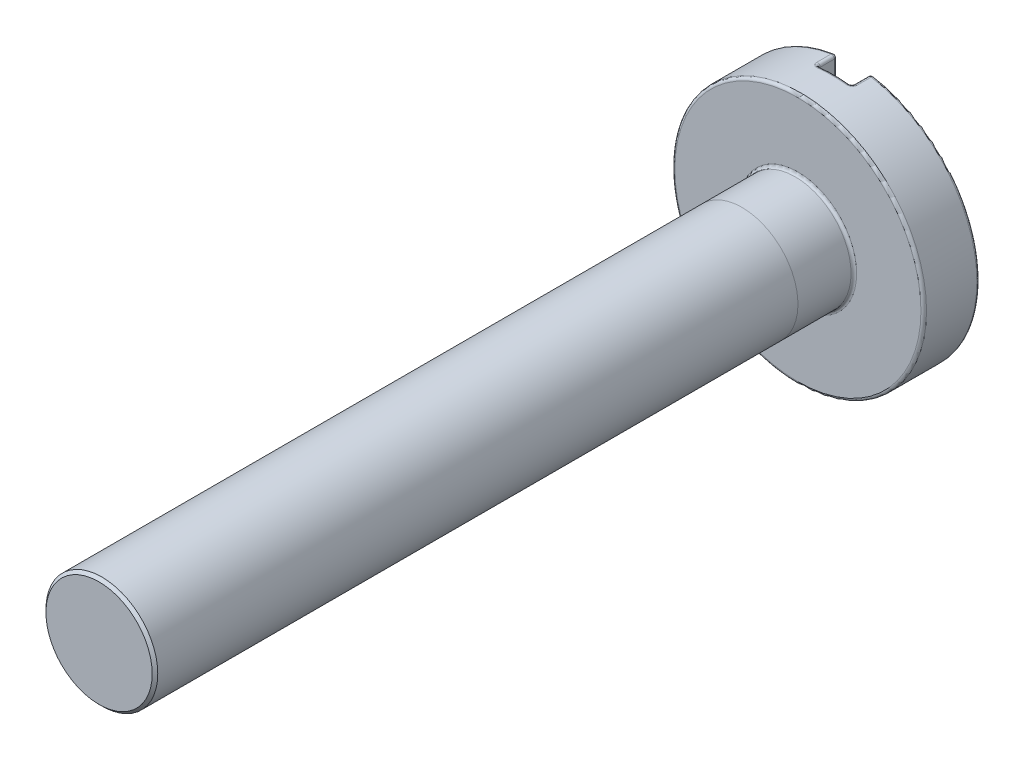
from build123d import *

# Parameters (mm, degrees)
SKETCH1_R           = 1
BOSS_EXTRUDE1_DEPTH = 12.5
SKETCH2_R           = 2.25
BOSS_EXTRUDE2_DEPTH = 1
SKETCH3_W           = 0.6
SKETCH3_H           = 8.393754192
CUT_EXTRUDE1_DEPTH  = 0.35
FILLET1_R           = 0.05
FILLET2_R           = 0.05
CHAMFER1_SIZE       = 0.05


with BuildPart() as part:
    # Sketch1 → Boss-Extrude1 (new body)
    with BuildSketch(Plane.XY):
        Circle(SKETCH1_R)
    extrude(amount=BOSS_EXTRUDE1_DEPTH)

    # Sketch2 → Boss-Extrude2 (add)
    with BuildSketch(Plane.XY):
        Circle(SKETCH2_R)
    extrude(amount=-BOSS_EXTRUDE2_DEPTH)

    # Sketch3 → Cut-Extrude1 (cut)
    with BuildSketch(Plane(origin=(0, 0, -1), x_dir=(-1, 0, 0), z_dir=(0, 0, -1))):
        Rectangle(SKETCH3_W, SKETCH3_H)
    extrude(amount=-CUT_EXTRUDE1_DEPTH, mode=Mode.SUBTRACT)

    # Fillet1
    fillet1_edges = [part.edges().sort_by_distance(p)[0] for p in [
        (-2.25, 0, -1),
        (1.693738469, -1.481131324, -1),
        (0.3, 0, -1),
        (-0.3, 0, -1),
        (0, 2.25, -0.65),
        (0, -2.25, -0.65),
        (-0.3, -2.229910312, -0.825),
        (-0.3, 2.229910312, -0.825),
        (0.3, 2.229910312, -0.825),
        (0.3, -2.229910312, -0.825),
        (-0.3, 0, -0.65),
        (0.3, 0, -0.65),
        (-1, 0, 0),
    ]]
    fillet(fillet1_edges, radius=FILLET1_R)

    # Fillet2
    fillet2_edges = [part.edges().sort_by_distance(p)[0] for p in [
        (-2.25, 0, 0),
    ]]
    fillet(fillet2_edges, radius=FILLET2_R)

    # Chamfer1
    chamfer1_edges = [part.edges().sort_by_distance(p)[0] for p in [
        (-1, 0, 12.5),
    ]]
    chamfer(chamfer1_edges, length=CHAMFER1_SIZE)


solid = part.part
